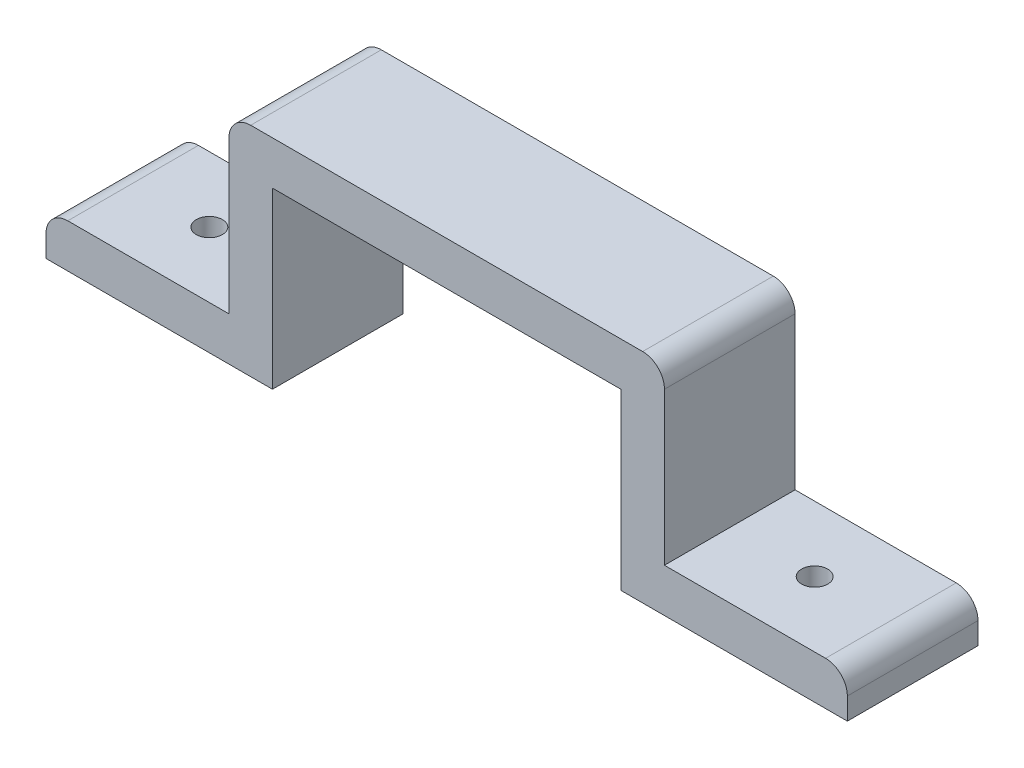
from build123d import *

# Parameters (mm, degrees)
BOSS_EXTRUDE1_DEPTH = 15
FILLET1_R           = 2.5
SKETCH2_R           = 1.5
CUT_EXTRUDE1_DEPTH  = 5


with BuildPart() as part:
    # Sketch1 → Boss-Extrude1 (new body)
    with BuildSketch(Plane.XY):
        Polygon((20, 20), (-20, 20), (-20, 0), (-46, 0), (-46, 5), (-25, 5), (-25, 25), (25, 25), (25, 5), (46, 5), (46, 0), (20, 0), align=None)
    extrude(amount=BOSS_EXTRUDE1_DEPTH)

    # Fillet1
    fillet1_edges = [part.edges().sort_by_distance(p)[0] for p in [
        (-25, 25, 7.5),
        (25, 25, 7.5),
        (46, 5, 7.5),
        (-46, 5, 7.5),
    ]]
    fillet(fillet1_edges, radius=FILLET1_R)

    # Sketch2 → Cut-Extrude1 (cut)
    with BuildSketch(Plane(origin=(0, 5, 0), x_dir=(1, 0, 0), z_dir=(0, 1, 0))):
        with Locations(Location((34.75, -7.5, 0), (0, 0, 270))):
            Circle(SKETCH2_R)
        with Locations(Location((-34.75, -7.5, 0), (0, 0, 270))):
            Circle(SKETCH2_R)
    extrude(amount=-CUT_EXTRUDE1_DEPTH, mode=Mode.SUBTRACT)


solid = part.part
